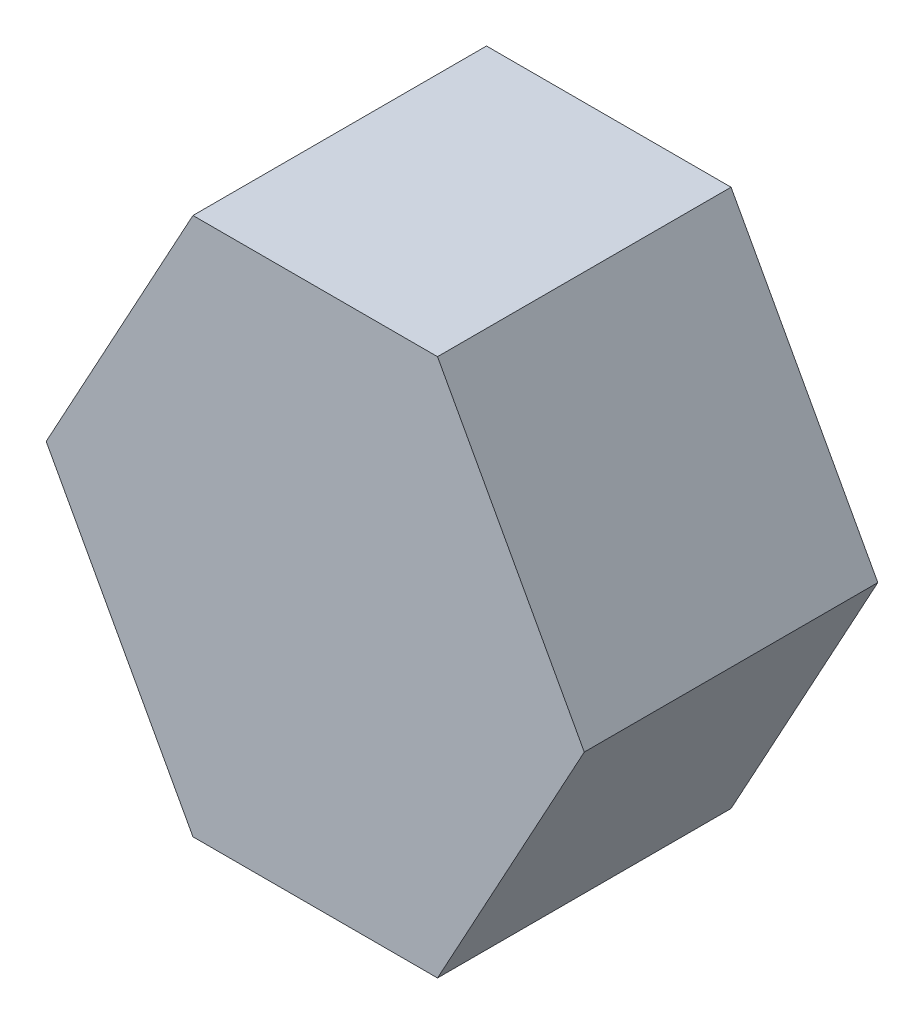
from build123d import *

# Parameters (mm, degrees)
SKETCH1_W                       = 12.7
SKETCH1_H                       = 12.7
BOSS_EXTRUDE1_DEPTH             = 6.928
TAP_DRILL_FOR_M3X0_5_TAP3_D     = 2.5
TAP_DRILL_FOR_M3X0_5_TAP3_DEPTH = 4
TAP_DRILL_FOR_M3X0_5_TAP3_TIP   = 0.751075774
CUT_EXTRUDE1_DEPTH              = 12.342053782
MIRROR2_COPY_1_DEPTH            = 12.342053782


with BuildPart() as part:
    # Sketch1 → Boss-Extrude1 (new body)
    with BuildSketch(Plane.XY):
        Rectangle(SKETCH1_W, SKETCH1_H)
    extrude(amount=BOSS_EXTRUDE1_DEPTH)

    # Tap Drill for M3x0.5 Tap3
    with Locations(Plane(origin=(0, 0, 0), x_dir=(1, 0, 0), z_dir=(0, 0, -1))):
        with Locations((0, 0)):
            Hole(TAP_DRILL_FOR_M3X0_5_TAP3_D / 2, depth=TAP_DRILL_FOR_M3X0_5_TAP3_DEPTH)
            with Locations((0, 0, -(TAP_DRILL_FOR_M3X0_5_TAP3_DEPTH + TAP_DRILL_FOR_M3X0_5_TAP3_TIP / 2))):  # 118° drill point
                Cone(0, TAP_DRILL_FOR_M3X0_5_TAP3_D / 2, TAP_DRILL_FOR_M3X0_5_TAP3_TIP, mode=Mode.SUBTRACT)

    # Sketch8 → Cut-Extrude1 (cut, symmetric)
    with BuildSketch(Plane.XY):
        Polygon((-16.943244885, 42.69979937), (2.886, 6.35), (6.35, 0), (26.179244885, -36.34979937), (98.878843624, 3.308690399), (55.756353855, 82.358289139), align=None)
    cut_extrude1 = extrude(amount=CUT_EXTRUDE1_DEPTH, both=True, mode=Mode.SUBTRACT)

    # Mirror1: Cut-Extrude1 across plane
    add(cut_extrude1.mirror(Plane.ZX), mode=Mode.SUBTRACT)

    # Mirror2: Cut-Extrude1 across plane
    add(cut_extrude1.mirror(Plane(origin=(0, 0, 0), x_dir=(0, 0, 1), z_dir=(1, 0, 0))), mode=Mode.SUBTRACT)

    # Mirror2 copy 1 sketch → Mirror2 copy 1 (cut, symmetric)
    with BuildSketch(Plane(origin=(0, 0, 0), x_dir=(-1, 0, 0), z_dir=(0, 0, 1))):
        Polygon((-16.943244885, 42.69979937), (2.886, 6.35), (6.35, 0), (26.179244885, -36.34979937), (98.878843624, 3.308690399), (55.756353855, 82.358289139), align=None)
    extrude(amount=MIRROR2_COPY_1_DEPTH, both=True, mode=Mode.SUBTRACT)


solid = part.part
